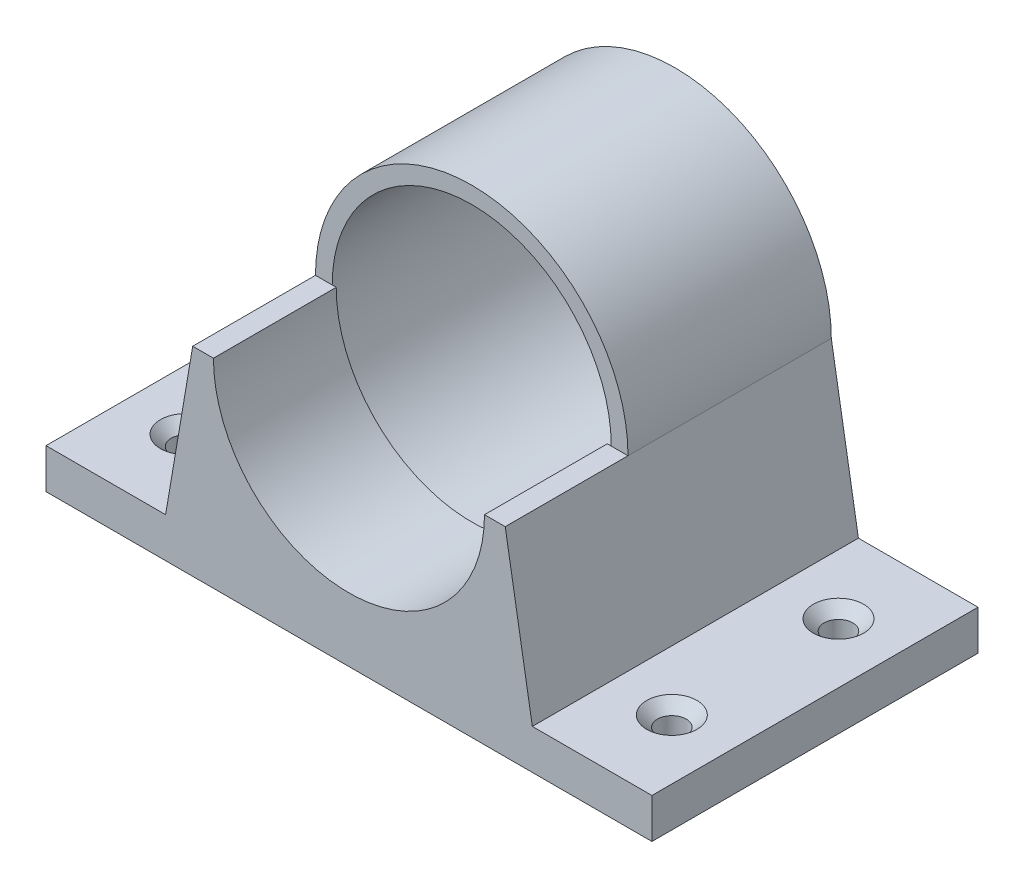
from build123d import *

# Parameters (mm, degrees)
SKETCH1_R                                       = 17.5
BOSS_EXTRUDE9_DEPTH                             = 25.5
BOSS_EXTRUDE10_DEPTH                            = 15.4
BOSS_EXTRUDE10_DEPTH_BACK                       = 25.5
CSK_FOR_M3_FLAT_HEAD_MACHINE_SCREW1_D           = 3.6
CSK_FOR_M3_FLAT_HEAD_MACHINE_SCREW1_CSINK_D     = 6.3
CSK_FOR_M3_FLAT_HEAD_MACHINE_SCREW1_CSINK_ANGLE = 90
CSK_FOR_M3_FLAT_HEAD_MACHINE_SCREW2_D           = 3.6
CSK_FOR_M3_FLAT_HEAD_MACHINE_SCREW2_CSINK_D     = 6.3
CSK_FOR_M3_FLAT_HEAD_MACHINE_SCREW2_CSINK_ANGLE = 90
BOSS_EXTRUDE11_DEPTH                            = 15.4
CUT_EXTRUDE3_REACH                              = 549.129
SKETCH17_R                                      = 1.8


with BuildPart() as part:
    # Sketch1 → Boss-Extrude9 (new body)
    with BuildSketch(Plane.XY):
        with BuildLine():
            ThreePointArc((-19.6, 18.153395679), (0, 37.753395679), (19.6, 18.153395679))
            ThreePointArc((19.6, 18.153395679), (0, -1.446604321), (-19.6, 18.153395679))
        make_face()
        with Locations((0, 18.153395679)):
            Circle(SKETCH1_R, mode=Mode.SUBTRACT)
    extrude(amount=-BOSS_EXTRUDE9_DEPTH)

    # Sketch1<15> → Boss-Extrude10 (add, two sides: drawn at the far end of the back side and taken through both)
    with BuildSketch(Plane.XY.offset(-BOSS_EXTRUDE10_DEPTH_BACK)):
        with BuildLine():
            Line((-23, -1.846604321), (-38, -1.846604321))
            Line((-38, -1.846604321), (-38, -6.846604321))
            Line((-38, -6.846604321), (38, -6.846604321))
            Line((38, -6.846604321), (38, -1.846604321))
            Line((38, -1.846604321), (23, -1.846604321))
            Line((23, -1.846604321), (19.6, 18.153395679))
            ThreePointArc((19.6, 18.153395679), (0, -1.446604321), (-19.6, 18.153395679))
            Line((-19.6, 18.153395679), (-23, -1.846604321))
        make_face()
    extrude(amount=BOSS_EXTRUDE10_DEPTH + BOSS_EXTRUDE10_DEPTH_BACK)

    # CSK for M3 Flat Head Machine Screw1 (through all)
    with Locations(Plane(origin=(0, -1.846604321, 0), x_dir=(1, 0, 0), z_dir=(0, 1, 0))):
        with Locations((-30.5, 15.5), (-30.5, -5.4)):
            CounterSinkHole(CSK_FOR_M3_FLAT_HEAD_MACHINE_SCREW1_D / 2, CSK_FOR_M3_FLAT_HEAD_MACHINE_SCREW1_CSINK_D / 2, counter_sink_angle=CSK_FOR_M3_FLAT_HEAD_MACHINE_SCREW1_CSINK_ANGLE)

    # CSK for M3 Flat Head Machine Screw2 (through all)
    with Locations(Plane(origin=(0, -1.846604321, 0), x_dir=(1, 0, 0), z_dir=(0, 1, 0))):
        with Locations((30.5, -5.4), (30.5, 15.5)):
            CounterSinkHole(CSK_FOR_M3_FLAT_HEAD_MACHINE_SCREW2_D / 2, CSK_FOR_M3_FLAT_HEAD_MACHINE_SCREW2_CSINK_D / 2, counter_sink_angle=CSK_FOR_M3_FLAT_HEAD_MACHINE_SCREW2_CSINK_ANGLE)

    # Sketch1<19> → Boss-Extrude11 (add)
    with BuildSketch(Plane.XY):
        with BuildLine():
            ThreePointArc((-19.6, 18.153395679), (0, -1.446604321), (19.6, 18.153395679))
            Line((19.6, 18.153395679), (17, 18.153395679))
            ThreePointArc((17, 18.153395679), (0, 1.153395679), (-17, 18.153395679))
            Line((-17, 18.153395679), (-19.6, 18.153395679))
        make_face()
    extrude(amount=BOSS_EXTRUDE11_DEPTH)

    # Sketch17 → Cut-Extrude3 (cut, up to next)
    with BuildSketch(Plane(origin=(-499.24894984, 9.974554813, -84.308871479), x_dir=(0.050830850863694654, -0.0009181581696580715, 0.9987068546806157), z_dir=(0.036090886531912496, 0.9993480899541041, -0.000918158169658168)), mode=Mode.PRIVATE) as cut_extrude3_sk1:
        with Locations((92.5, 462.5)):
            Circle(SKETCH17_R)
    cut_extrude3_tool1 = extrude(cut_extrude3_sk1.sketch, amount=-CUT_EXTRUDE3_REACH, mode=Mode.PRIVATE) & part.part
    # Sketch17 → Cut-Extrude3 (cut, up to next)
    with BuildSketch(Plane(origin=(-499.24894984, 9.974554813, -84.308871479), x_dir=(0.050830850863694654, -0.0009181581696580715, 0.9987068546806157), z_dir=(0.036090886531912496, 0.9993480899541041, -0.000918158169658168)), mode=Mode.PRIVATE) as cut_extrude3_sk2:
        with Locations((113.4, 462.5)):
            Circle(SKETCH17_R)
    cut_extrude3_tool2 = extrude(cut_extrude3_sk2.sketch, amount=-CUT_EXTRUDE3_REACH, mode=Mode.PRIVATE) & part.part
    add(cut_extrude3_tool1.solids().sort_by_distance((-32.946684, -6.80241, -15.437756))[0], mode=Mode.SUBTRACT)
    add(cut_extrude3_tool2.solids().sort_by_distance((-31.884319, -6.821599, 5.435217))[0], mode=Mode.SUBTRACT)


solid = part.part
